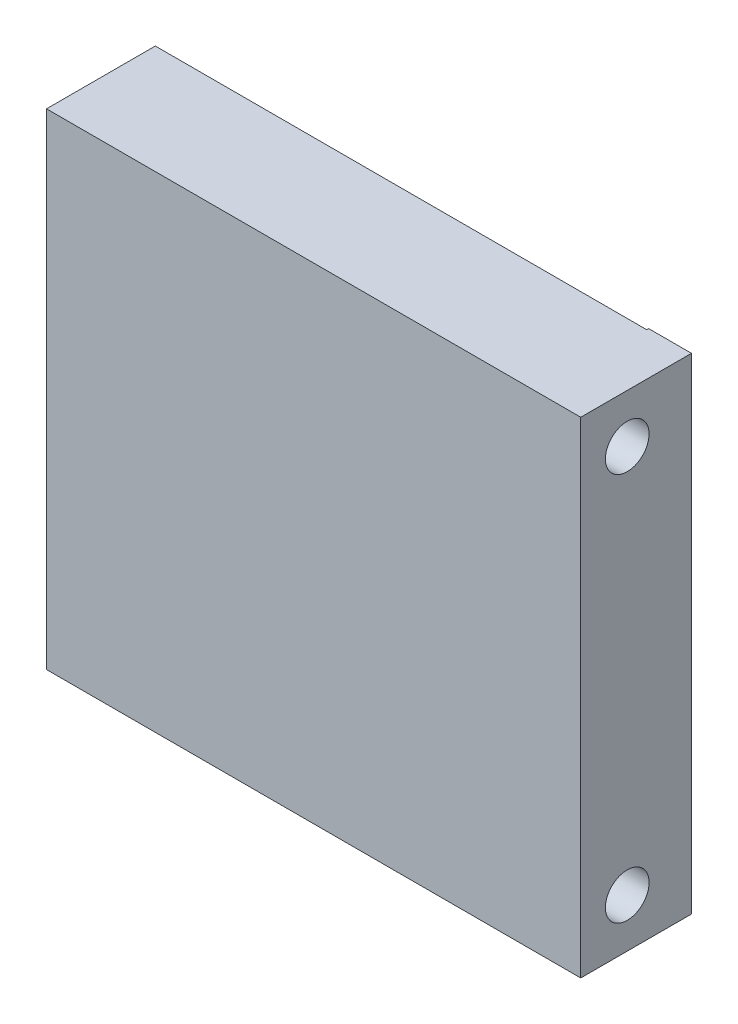
from build123d import *

# Parameters (mm, degrees)
BOSS_EXTRUDE1_DEPTH = 1
SKETCH2_W           = 50
SKETCH2_H           = 11.4
BOSS_EXTRUDE2_DEPTH = 4.4
SKETCH3_R           = 2.25
CUT_EXTRUDE1_DEPTH  = 4.4
SKETCH4_W           = 50.6
SKETCH4_H           = 5.5
BOSS_EXTRUDE3_DEPTH = 6.4
SKETCH5_W           = 50.6
SKETCH5_H           = 4.5
BOSS_EXTRUDE4_DEPTH = 1.8
SKETCH6_W           = 50.6
SKETCH6_H           = 5.5
BOSS_EXTRUDE5_DEPTH = 2


with BuildPart() as part:
    # Sketch1 → Boss-Extrude1 (new body)
    with BuildSketch(Plane(origin=(0, 0, 0), x_dir=(0, 1, 0), z_dir=(0, 0, 1))):
        Polygon((-25, 25.3), (19, 25.3), (25, 25.3), (25, -25.3), (-25, -25.3), align=None)
    extrude(amount=BOSS_EXTRUDE1_DEPTH)

    # Sketch2 → Boss-Extrude2 (add)
    with BuildSketch(Plane.YZ.offset(25.3)):
        with Locations((0, -4.7)):
            Rectangle(SKETCH2_W, SKETCH2_H)
    extrude(amount=BOSS_EXTRUDE2_DEPTH)

    # Sketch3 → Cut-Extrude1 (cut)
    with BuildSketch(Plane.YZ.offset(29.7)):
        with Locations(Location((-20, -3.787139035, 0), (0, 0, 270))):
            Circle(SKETCH3_R)
        with Locations(Location((20, -3.787139035, 0), (0, 0, 270))):
            Circle(SKETCH3_R)
    extrude(amount=-CUT_EXTRUDE1_DEPTH, mode=Mode.SUBTRACT)

    # Sketch4 → Boss-Extrude3 (add)
    with BuildSketch(Plane(origin=(0, 0, 0), x_dir=(1, 0, 0), z_dir=(0, 0, -1))):
        with Locations((0, -22.25)):
            Rectangle(SKETCH4_W, SKETCH4_H)
        with Locations((0, 22.25)):
            Rectangle(SKETCH4_W, SKETCH4_H)
    extrude(amount=BOSS_EXTRUDE3_DEPTH)

    # Sketch5 → Boss-Extrude4 (add)
    with BuildSketch(Plane(origin=(0, 0, -6.4), x_dir=(1, 0, 0), z_dir=(0, 0, -1))):
        with Locations((0, 22.75)):
            Rectangle(SKETCH5_W, SKETCH5_H)
        with Locations((0, -22.75)):
            Rectangle(SKETCH5_W, SKETCH5_H)
    extrude(amount=BOSS_EXTRUDE4_DEPTH)

    # Sketch6 → Boss-Extrude5 (add)
    with BuildSketch(Plane(origin=(0, 0, -8.2), x_dir=(1, 0, 0), z_dir=(0, 0, -1))):
        with Locations((0, -22.25)):
            Rectangle(SKETCH6_W, SKETCH6_H)
        with Locations((0, 22.25)):
            Rectangle(SKETCH6_W, SKETCH6_H)
    extrude(amount=BOSS_EXTRUDE5_DEPTH)


solid = part.part
